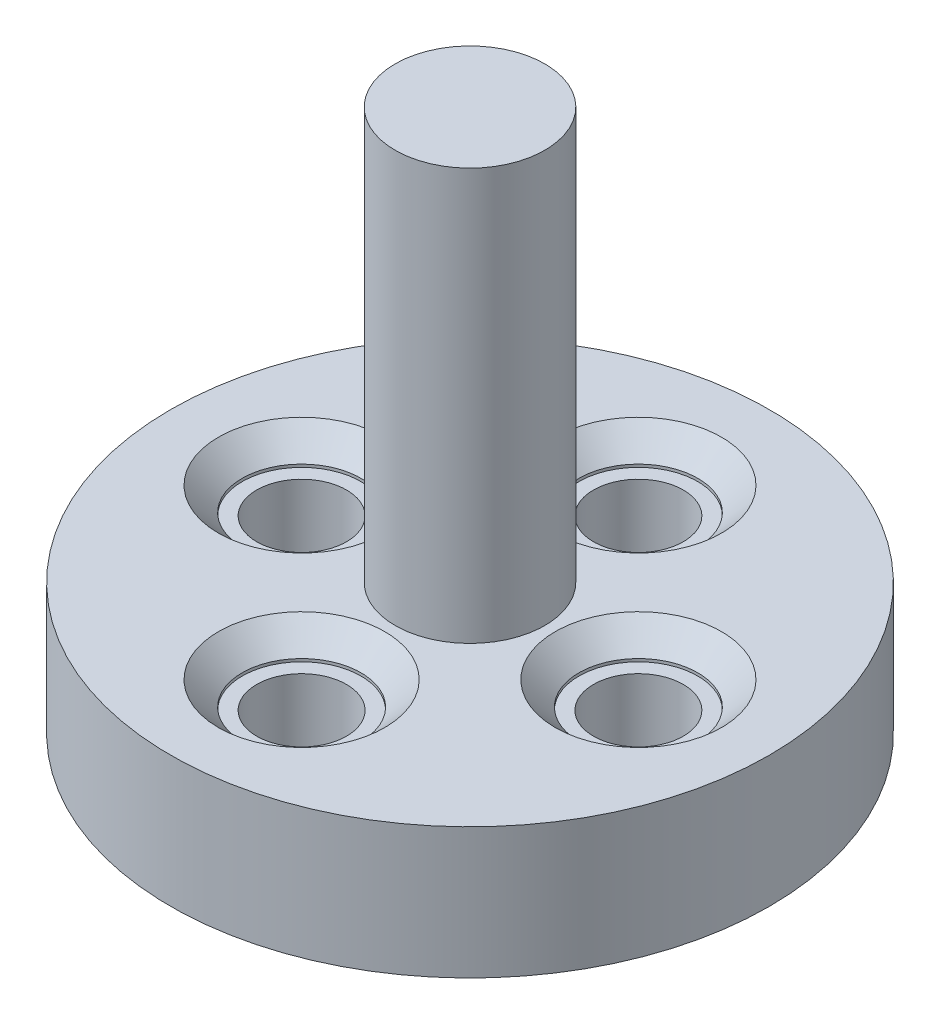
from build123d import *

# Parameters (mm, degrees)
CBORE_FOR_00_BINDING_HEAD_MACHINE_S_2_COUNT = 2
CBORE_FOR_00_BINDING_HEAD_MACHINE_S_2_PITCH = 6.363961031
CBORE_FOR_00_BINDING_HEAD_MACHINE_S_3_COUNT = 2
CBORE_FOR_00_BINDING_HEAD_MACHINE_S_3_PITCH = 9
CBORE_FOR_00_BINDING_HEAD_MACHINE_S_4_COUNT = 2
CBORE_FOR_00_BINDING_HEAD_MACHINE_S_4_PITCH = 6.363961031
SKETCH10_R                                  = 1.2
CUT_EXTRUDE1_DEPTH                          = 20.386059671
SKETCH11_R                                  = 1.266741203
CUT_EXTRUDE2_DEPTH                          = 4


with BuildPart() as part:
    # Sketch1 → Revolve1 (revolve)
    with BuildSketch(Plane.XY, mode=Mode.PRIVATE) as revolve1_sk:
        Polygon((-5.813736264, 6.85), (-5.813736264, -7.65), (2.186263736, -7.65), (2.186263736, -4.15), (-3.813736264, -4.15), (-3.813736264, 6.85), align=None)
    revolve(revolve1_sk.sketch.rotate(Axis((-5.813736264, 6.85, 0), (0, -1, 0)), 180), axis=Axis((-5.813736264, 6.85, 0), (0, -1, 0)))

    # Sketch7 → CBORE for #00 Binding Head Machine Screw1 (revolve, cut)
    with BuildSketch(Plane(origin=(-10.313736264, -4.15, 0), x_dir=(0, 0, 1), z_dir=(1, 0, 0))):
        Polygon((0, 0), (0, 0.469701142), (0.6985, 0.05), (0.6985, 0.7112), (1.5875, 0.7112), (1.5875, 0.635), (2.2225, 0), align=None)
    cbore_for_00_binding_head_machine_screw = revolve(axis=Axis((-10.313736264, 2.2, 0), (0, -1, 0)), mode=Mode.SUBTRACT)

    # CBORE for _00 Binding Head Machine S 2: CBORE for #00 Binding Head Machine Screw1 ×2
    with Locations(*[Vector(0.7071067811865475, 0, -0.7071067811865477) * (i * CBORE_FOR_00_BINDING_HEAD_MACHINE_S_2_PITCH) for i in range(1, CBORE_FOR_00_BINDING_HEAD_MACHINE_S_2_COUNT)]):
        add(cbore_for_00_binding_head_machine_screw, mode=Mode.SUBTRACT)

    # CBORE for _00 Binding Head Machine S 3: CBORE for #00 Binding Head Machine Screw1 ×2
    with Locations(*[(i * CBORE_FOR_00_BINDING_HEAD_MACHINE_S_3_PITCH, 0, 0) for i in range(1, CBORE_FOR_00_BINDING_HEAD_MACHINE_S_3_COUNT)]):
        add(cbore_for_00_binding_head_machine_screw, mode=Mode.SUBTRACT)

    # CBORE for _00 Binding Head Machine S 4: CBORE for #00 Binding Head Machine Screw1 ×2
    with Locations(*[Vector(0.7071067811865475, 0, 0.7071067811865477) * (i * CBORE_FOR_00_BINDING_HEAD_MACHINE_S_4_PITCH) for i in range(1, CBORE_FOR_00_BINDING_HEAD_MACHINE_S_4_COUNT)]):
        add(cbore_for_00_binding_head_machine_screw, mode=Mode.SUBTRACT)

    # Sketch10 → Cut-Extrude1 (cut, through all)
    with BuildSketch(Plane(origin=(0, -4.15, 0), x_dir=(1, 0, 0), z_dir=(0, 1, 0))):
        with Locations(Location((-10.313736264, 0, 0), (0, 0, 180))):
            Circle(SKETCH10_R)
        with Locations(Location((-5.813736264, 4.5, 0), (0, 0, 180))):
            Circle(SKETCH10_R)
        with Locations(Location((-1.313736264, 0, 0), (0, 0, 180))):
            Circle(SKETCH10_R)
        with Locations(Location((-5.813736264, -4.5, 0), (0, 0, 180))):
            Circle(SKETCH10_R)
    extrude(amount=-CUT_EXTRUDE1_DEPTH, mode=Mode.SUBTRACT)

    # Sketch11 → Cut-Extrude2 (cut)
    with BuildSketch(Plane.XZ.offset(7.65)):
        with Locations((-5.813736264, 0)):
            Circle(SKETCH11_R)
    extrude(amount=-CUT_EXTRUDE2_DEPTH, mode=Mode.SUBTRACT)


solid = part.part
